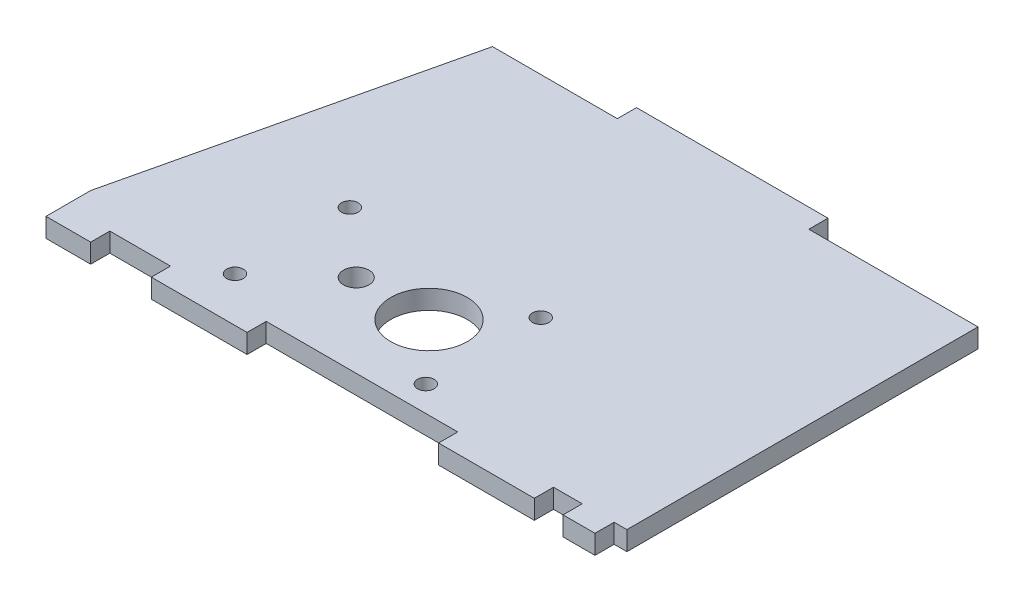
from build123d import *

# Parameters (mm, degrees)
SKETCH1_R           = 2
SKETCH1_R_2         = 6
SKETCH1_R_3         = 1.3
BOSS_EXTRUDE1_DEPTH = 3


with BuildPart() as part:
    # Sketch1 → Boss-Extrude1 (new body)
    with BuildSketch(Plane(origin=(0, 0, 0), x_dir=(1, 0, 0), z_dir=(0, 1, 0))):
        Polygon((-95.483372271, 27.767651072), (-80.483372271, 27.767651072), (-80.483372271, 30.767651072), (-50.483372271, 30.767651072), (-50.483372271, 27.767651072), (-35.483372271, 27.767651072), (-25.983372271, 27.767651072), (-23.983372271, 27.767651072), (-23.983372271, -27.232348928), (-25.983372271, -27.232348928), (-25.983372271, -30.232348928), (-30.983372271, -30.232348928), (-30.983372271, -27.232348928), (-35.483372271, -27.232348928), (-35.483372271, -30.232348928), (-50.483372271, -30.232348928), (-50.483372271, -27.232348928), (-80.483372271, -27.232348928), (-80.483372271, -30.232348928), (-95.483372271, -30.232348928), (-95.483372271, -27.232348928), (-104.983372271, -27.232348928), (-104.983372271, -30.232348928), (-111.983372271, -30.232348928), (-111.983372271, -27.232348928), (-111.983372271, -23.232348928), (-100.033372271, 27.767651072), align=None)
        with Locations(Location((-79.383372271, -14.232348928, 0), (0, 0, 270))):
            Circle(SKETCH1_R, mode=Mode.SUBTRACT)
        with Locations(Location((-67.983372271, -14.232348928, 0), (0, 0, 270))):
            Circle(SKETCH1_R_2, mode=Mode.SUBTRACT)
        with Locations(Location((-59.483372271, -23.232348928, 0), (0, 0, 270))):
            Circle(SKETCH1_R_3, mode=Mode.SUBTRACT)
        with Locations(Location((-59.483372271, -5.232348928, 0), (0, 0, 270))):
            Circle(SKETCH1_R_3, mode=Mode.SUBTRACT)
        with Locations(Location((-89.383372271, -5.232348928, 0), (0, 0, 270))):
            Circle(SKETCH1_R_3, mode=Mode.SUBTRACT)
        with Locations(Location((-89.383372271, -23.232348928, 0), (0, 0, 270))):
            Circle(SKETCH1_R_3, mode=Mode.SUBTRACT)
    extrude(amount=BOSS_EXTRUDE1_DEPTH)


solid = part.part
